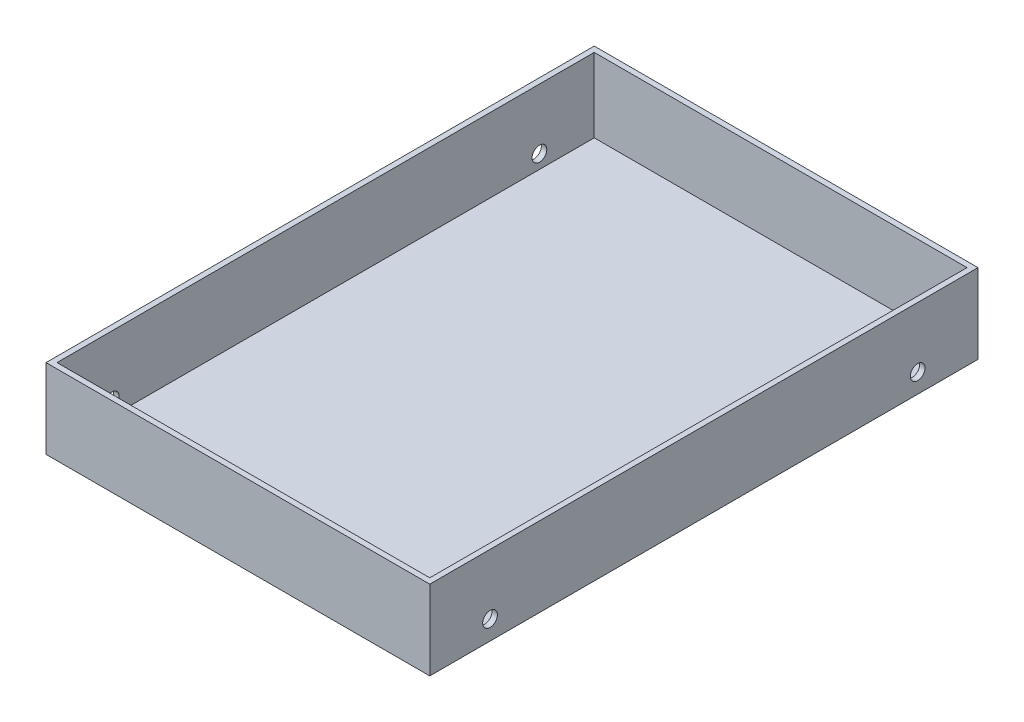
from build123d import *

# Parameters (mm, degrees)
SKETCH1_W               = 350
SKETCH1_H               = 500
BOSS_EXTRUDE1_DEPTH     = 72.5
SHELL1_T                = -5
CUT_EXTRUDE1_DEPTH      = 437.183734222
CUT_EXTRUDE1_DEPTH_BACK = 437.183734222
SKETCH2_R               = 6.723131081


with BuildPart() as part:
    # Sketch1 → Boss-Extrude1 (new body)
    with BuildSketch(Plane(origin=(0, 0, 0), x_dir=(1, 0, 0), z_dir=(0, 1, 0))):
        Rectangle(SKETCH1_W, SKETCH1_H)
    extrude(amount=BOSS_EXTRUDE1_DEPTH)

    # Shell1
    shell1_openings = [part.faces().sort_by_distance(p)[0] for p in [
        (0, 72.5, 0),
    ]]
    offset(amount=SHELL1_T, openings=shell1_openings, kind=Kind.INTERSECTION)

    # Sketch2 → Cut-Extrude1 (cut, two sides: drawn at the far end of the back side and taken through both)
    with BuildSketch(Plane(origin=(175, 0, 0), x_dir=(0, 0, -1), z_dir=(1, 0, 0)).offset(-CUT_EXTRUDE1_DEPTH_BACK)):
        with Locations((-195, 17.5)):
            Circle(SKETCH2_R)
        with Locations((195, 17.5)):
            Circle(SKETCH2_R)
    extrude(amount=CUT_EXTRUDE1_DEPTH + CUT_EXTRUDE1_DEPTH_BACK, mode=Mode.SUBTRACT)


solid = part.part
